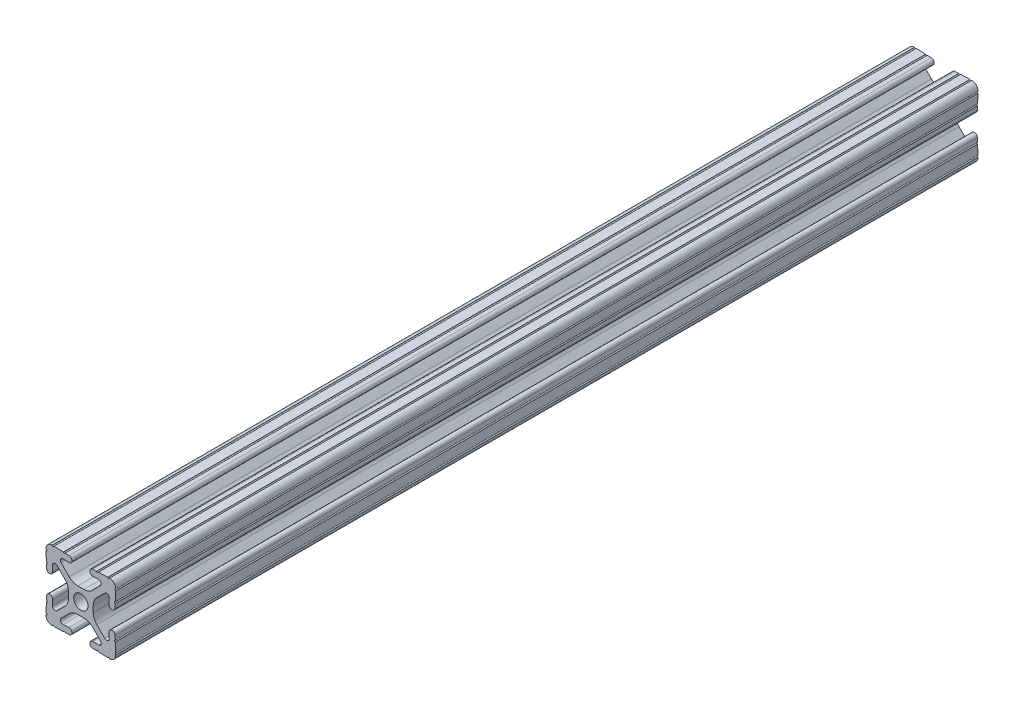
from build123d import *

# Parameters (mm, degrees)
SKETCH3_R      = 2.6035
EXTRUDE1_DEPTH = 157.05


with BuildPart() as part:
    # Sketch3 → Extrude1 (new, symmetric)
    with BuildSketch(Plane.XY):
        with BuildLine():
            Line((-1.115277175, 4.5085), (1.115277175, 4.5085))
            ThreePointArc((1.115277175, 4.5085), (2.806584872, 4.844922018), (4.240406305, 5.80297087))
            Line((4.240406305, 5.80297087), (7.148423664, 8.710988229))
            ThreePointArc((7.148423664, 8.710988229), (7.349906316, 9.772227925), (6.436353897, 10.348636575))
            Line((6.436353897, 10.348636575), (4.381960454, 10.276895575))
            ThreePointArc((4.381960454, 10.276895575), (3.239173075, 11.342562046), (4.304839546, 12.485349424))
            Line((4.304839546, 12.485349424), (5.728246175, 12.535055879))
            ThreePointArc((5.728246175, 12.535055879), (6.054756855, 12.230579745), (6.35923299, 12.557090424))
            Line((6.35923299, 12.557090424), (9.782092278, 12.676619304))
            ThreePointArc((9.782092278, 12.676619304), (10.108602958, 12.37214317), (10.413079092, 12.69865385))
            ThreePointArc((10.413079092, 12.69865385), (12.052764565, 12.052764565), (12.69865385, 10.413079092))
            ThreePointArc((12.69865385, 10.413079092), (12.37214317, 10.108602958), (12.676619304, 9.782092278))
            Line((12.676619304, 9.782092278), (12.557090424, 6.35923299))
            ThreePointArc((12.557090424, 6.35923299), (12.230579745, 6.054756855), (12.535055879, 5.728246175))
            Line((12.535055879, 5.728246175), (12.485349424, 4.304839546))
            ThreePointArc((12.485349424, 4.304839546), (11.342562046, 3.239173075), (10.276895575, 4.381960454))
            Line((10.276895575, 4.381960454), (10.348636575, 6.436353897))
            ThreePointArc((10.348636575, 6.436353897), (9.772227925, 7.349906316), (8.710988229, 7.148423664))
            Line((8.710988229, 7.148423664), (5.80297087, 4.240406305))
            ThreePointArc((5.80297087, 4.240406305), (4.844922018, 2.806584872), (4.5085, 1.115277175))
            Line((4.5085, 1.115277175), (4.5085, -1.115277175))
            ThreePointArc((4.5085, -1.115277175), (4.844922018, -2.806584872), (5.80297087, -4.240406305))
            Line((5.80297087, -4.240406305), (8.710988229, -7.148423664))
            ThreePointArc((8.710988229, -7.148423664), (9.772227925, -7.349906316), (10.348636575, -6.436353897))
            Line((10.348636575, -6.436353897), (10.276895575, -4.381960454))
            ThreePointArc((10.276895575, -4.381960454), (11.342562046, -3.239173075), (12.485349424, -4.304839546))
            Line((12.485349424, -4.304839546), (12.535055879, -5.728246175))
            ThreePointArc((12.535055879, -5.728246175), (12.230579745, -6.054756855), (12.557090424, -6.35923299))
            Line((12.557090424, -6.35923299), (12.676619304, -9.782092278))
            ThreePointArc((12.676619304, -9.782092278), (12.37214317, -10.108602958), (12.69865385, -10.413079092))
            ThreePointArc((12.69865385, -10.413079092), (12.052764565, -12.052764565), (10.413079092, -12.69865385))
            ThreePointArc((10.413079092, -12.69865385), (10.108602958, -12.37214317), (9.782092278, -12.676619304))
            Line((9.782092278, -12.676619304), (6.35923299, -12.557090424))
            ThreePointArc((6.35923299, -12.557090424), (6.054756855, -12.230579745), (5.728246175, -12.535055879))
            Line((5.728246175, -12.535055879), (4.304839546, -12.485349424))
            ThreePointArc((4.304839546, -12.485349424), (3.239173075, -11.342562046), (4.381960454, -10.276895575))
            Line((4.381960454, -10.276895575), (6.436353897, -10.348636575))
            ThreePointArc((6.436353897, -10.348636575), (7.349906316, -9.772227925), (7.148423664, -8.710988229))
            Line((7.148423664, -8.710988229), (4.240406305, -5.80297087))
            ThreePointArc((4.240406305, -5.80297087), (2.806584872, -4.844922018), (1.115277175, -4.5085))
            Line((1.115277175, -4.5085), (-1.115277175, -4.5085))
            ThreePointArc((-1.115277175, -4.5085), (-2.806584872, -4.844922018), (-4.240406305, -5.80297087))
            Line((-4.240406305, -5.80297087), (-7.148423664, -8.710988229))
            ThreePointArc((-7.148423664, -8.710988229), (-7.349906316, -9.772227925), (-6.436353897, -10.348636575))
            Line((-6.436353897, -10.348636575), (-4.381960454, -10.276895575))
            ThreePointArc((-4.381960454, -10.276895575), (-3.239173075, -11.342562046), (-4.304839546, -12.485349424))
            Line((-4.304839546, -12.485349424), (-5.728246175, -12.535055879))
            ThreePointArc((-5.728246175, -12.535055879), (-6.054756855, -12.230579745), (-6.35923299, -12.557090424))
            Line((-6.35923299, -12.557090424), (-9.782092278, -12.676619304))
            ThreePointArc((-9.782092278, -12.676619304), (-10.108602958, -12.37214317), (-10.413079092, -12.69865385))
            ThreePointArc((-10.413079092, -12.69865385), (-12.052764565, -12.052764565), (-12.69865385, -10.413079092))
            ThreePointArc((-12.69865385, -10.413079092), (-12.37214317, -10.108602958), (-12.676619304, -9.782092278))
            Line((-12.676619304, -9.782092278), (-12.557090424, -6.35923299))
            ThreePointArc((-12.557090424, -6.35923299), (-12.230579745, -6.054756855), (-12.535055879, -5.728246175))
            Line((-12.535055879, -5.728246175), (-12.485349424, -4.304839546))
            ThreePointArc((-12.485349424, -4.304839546), (-11.342562046, -3.239173075), (-10.276895575, -4.381960454))
            Line((-10.276895575, -4.381960454), (-10.348636575, -6.436353897))
            ThreePointArc((-10.348636575, -6.436353897), (-9.772227925, -7.349906316), (-8.710988229, -7.148423664))
            Line((-8.710988229, -7.148423664), (-5.80297087, -4.240406305))
            ThreePointArc((-5.80297087, -4.240406305), (-4.844922018, -2.806584872), (-4.5085, -1.115277175))
            Line((-4.5085, -1.115277175), (-4.5085, 1.115277175))
            ThreePointArc((-4.5085, 1.115277175), (-4.844922018, 2.806584872), (-5.80297087, 4.240406305))
            Line((-5.80297087, 4.240406305), (-8.710988229, 7.148423664))
            ThreePointArc((-8.710988229, 7.148423664), (-9.772227925, 7.349906316), (-10.348636575, 6.436353897))
            Line((-10.348636575, 6.436353897), (-10.276895575, 4.381960454))
            ThreePointArc((-10.276895575, 4.381960454), (-11.342562046, 3.239173075), (-12.485349424, 4.304839546))
            Line((-12.485349424, 4.304839546), (-12.535055879, 5.728246175))
            ThreePointArc((-12.535055879, 5.728246175), (-12.230579745, 6.054756855), (-12.557090424, 6.35923299))
            Line((-12.557090424, 6.35923299), (-12.676619304, 9.782092278))
            ThreePointArc((-12.676619304, 9.782092278), (-12.37214317, 10.108602958), (-12.69865385, 10.413079092))
            ThreePointArc((-12.69865385, 10.413079092), (-12.052764565, 12.052764565), (-10.413079092, 12.69865385))
            ThreePointArc((-10.413079092, 12.69865385), (-10.108602958, 12.37214317), (-9.782092278, 12.676619304))
            Line((-9.782092278, 12.676619304), (-6.35923299, 12.557090424))
            ThreePointArc((-6.35923299, 12.557090424), (-6.054756855, 12.230579745), (-5.728246175, 12.535055879))
            Line((-5.728246175, 12.535055879), (-4.304839546, 12.485349424))
            ThreePointArc((-4.304839546, 12.485349424), (-3.239173075, 11.342562046), (-4.381960454, 10.276895575))
            Line((-4.381960454, 10.276895575), (-6.436353897, 10.348636575))
            ThreePointArc((-6.436353897, 10.348636575), (-7.349906316, 9.772227925), (-7.148423664, 8.710988229))
            Line((-7.148423664, 8.710988229), (-4.240406305, 5.80297087))
            ThreePointArc((-4.240406305, 5.80297087), (-2.806584872, 4.844922018), (-1.115277175, 4.5085))
        make_face()
        Circle(SKETCH3_R, mode=Mode.SUBTRACT)
    extrude(amount=EXTRUDE1_DEPTH, both=True)


solid = part.part
